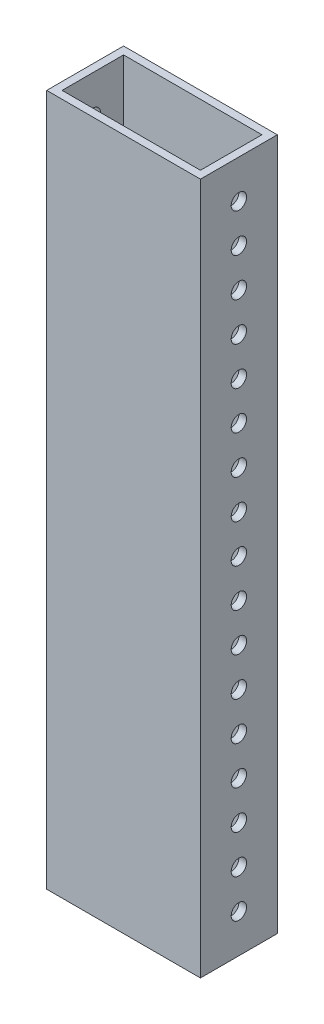
from build123d import *

# Parameters (mm, degrees)
SKETCH1_W           = 50.8
SKETCH1_H           = 25.4
SKETCH1_W_2         = 45.72
SKETCH1_H_2         = 20.32
BOSS_EXTRUDE1_DEPTH = 228.6
SKETCH2_R           = 2.54
CUT_EXTRUDE1_DEPTH  = 228.6


with BuildPart() as part:
    # Sketch1 → Boss-Extrude1 (new body)
    with BuildSketch(Plane(origin=(0, 0, 0), x_dir=(1, 0, 0), z_dir=(0, 1, 0))):
        with Locations((-4.028965517, 7.663793103)):
            Rectangle(SKETCH1_W, SKETCH1_H)
        with Locations((-4.028965517, 7.663793103)):
            Rectangle(SKETCH1_W_2, SKETCH1_H_2, mode=Mode.SUBTRACT)
    extrude(amount=BOSS_EXTRUDE1_DEPTH)

    # Sketch2 → Cut-Extrude1 (cut)
    with BuildSketch(Plane(origin=(21.371034483, 0, 0), x_dir=(0, 0, -1), z_dir=(1, 0, 0))):
        with Locations((7.663793103, 215.9)):
            Circle(SKETCH2_R)
        with Locations((7.663793103, 203.2)):
            Circle(SKETCH2_R)
        with Locations((7.663793103, 190.5)):
            Circle(SKETCH2_R)
        with Locations((7.663793103, 177.8)):
            Circle(SKETCH2_R)
        with Locations((7.663793103, 165.1)):
            Circle(SKETCH2_R)
        with Locations((7.663793103, 152.4)):
            Circle(SKETCH2_R)
        with Locations((7.663793103, 139.7)):
            Circle(SKETCH2_R)
        with Locations((7.663793103, 127)):
            Circle(SKETCH2_R)
        with Locations((7.663793103, 114.3)):
            Circle(SKETCH2_R)
        with Locations((7.663793103, 101.6)):
            Circle(SKETCH2_R)
        with Locations((7.663793103, 88.9)):
            Circle(SKETCH2_R)
        with Locations((7.663793103, 76.2)):
            Circle(SKETCH2_R)
        with Locations((7.663793103, 63.5)):
            Circle(SKETCH2_R)
        with Locations((7.663793103, 50.8)):
            Circle(SKETCH2_R)
        with Locations((7.663793103, 38.1)):
            Circle(SKETCH2_R)
        with Locations((7.663793103, 25.4)):
            Circle(SKETCH2_R)
        with Locations((7.663793103, 12.7)):
            Circle(SKETCH2_R)
    extrude(amount=-CUT_EXTRUDE1_DEPTH, mode=Mode.SUBTRACT)


solid = part.part
